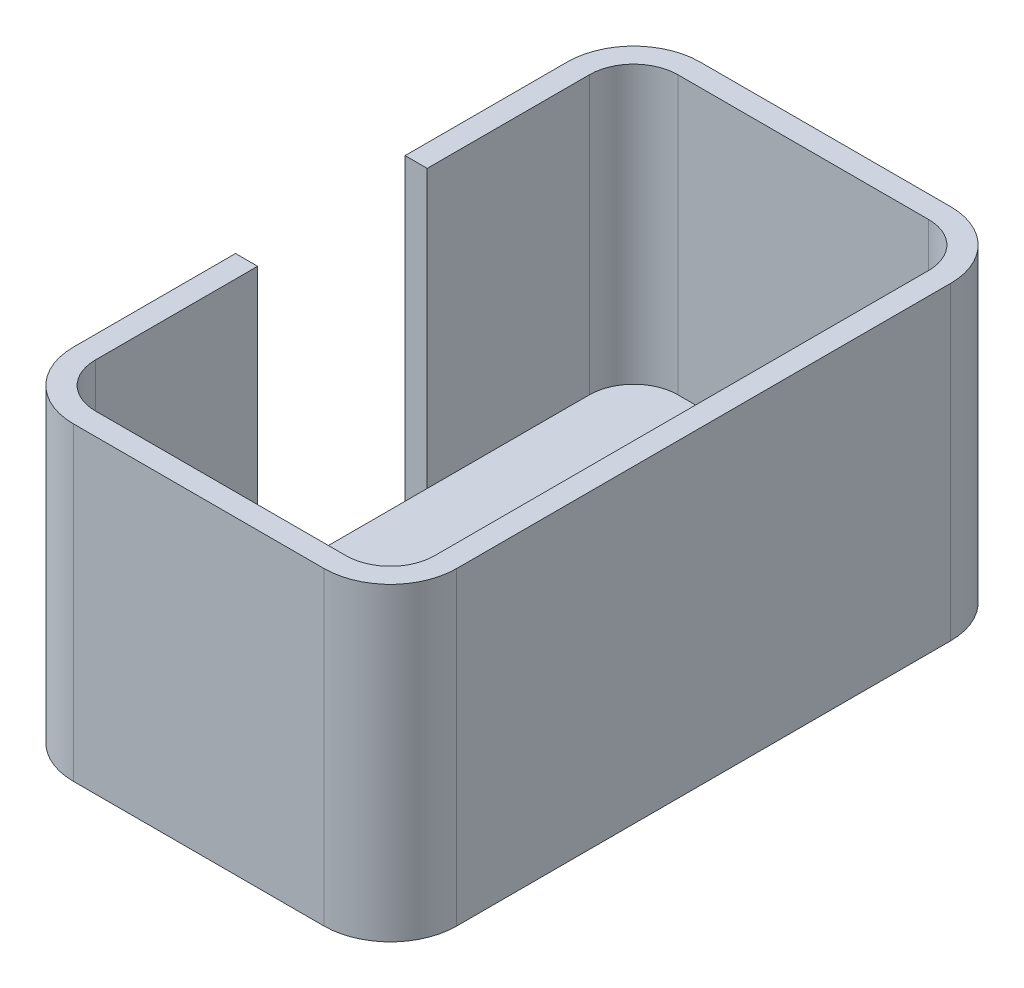
from build123d import *

# Parameters (mm, degrees)
EXTRUDE_1_DEPTH   = 21
EXTRUDE_1_2_DEPTH = 2.2


with BuildPart() as part:
    # 草图2 → Extrude 1 (new body)
    with BuildSketch(Plane(origin=(0, 0, 0), x_dir=(1, 0, 0), z_dir=(0, 1, 0))):
        with BuildLine():
            Line((-11.5, -5.75), (-11.5, -16.75))
            ThreePointArc((-11.5, -16.75), (-10.621320344, -18.871320344), (-8.5, -19.75))
            Line((-8.5, -19.75), (8.5, -19.75))
            ThreePointArc((8.5, -19.75), (10.621320344, -18.871320344), (11.5, -16.75))
            Line((11.5, -16.75), (11.5, 16.75))
            ThreePointArc((11.5, 16.75), (10.621320344, 18.871320344), (8.5, 19.75))
            Line((8.5, 19.75), (-8.5, 19.75))
            ThreePointArc((-8.5, 19.75), (-10.621320344, 18.871320344), (-11.5, 16.75))
            Line((-11.5, 16.75), (-11.5, 5.75))
            Line((-11.5, 5.75), (-13, 5.75))
            Line((-13, 5.75), (-13, 16.75))
            ThreePointArc((-13, 16.75), (-11.681980515, 19.931980515), (-8.5, 21.25))
            Line((-8.5, 21.25), (8.5, 21.25))
            ThreePointArc((8.5, 21.25), (11.681980515, 19.931980515), (13, 16.75))
            Line((13, 16.75), (13, -16.75))
            ThreePointArc((13, -16.75), (11.681980515, -19.931980515), (8.5, -21.25))
            Line((8.5, -21.25), (-8.5, -21.25))
            ThreePointArc((-8.5, -21.25), (-11.681980515, -19.931980515), (-13, -16.75))
            Line((-13, -16.75), (-13, -5.75))
            Line((-13, -5.75), (-11.5, -5.75))
        make_face()
    extrude(amount=EXTRUDE_1_DEPTH)

    # 草图3 → Extrude 1 2 (add)
    with BuildSketch(Plane(origin=(0, 0, 0), x_dir=(1, 0, 0), z_dir=(0, 1, 0))):
        with BuildLine():
            Line((-8.5, -19.75), (8.5, -19.75))
            ThreePointArc((8.5, -19.75), (10.621320344, -18.871320344), (11.5, -16.75))
            Line((11.5, -16.75), (11.5, 16.75))
            ThreePointArc((11.5, 16.75), (10.621320344, 18.871320344), (8.5, 19.75))
            Line((8.5, 19.75), (-8.5, 19.75))
            ThreePointArc((-8.5, 19.75), (-10.621320344, 18.871320344), (-11.5, 16.75))
            Line((-11.5, 16.75), (-11.5, 5.75))
            Line((-11.5, 5.75), (-11.5, 0))
            Line((-11.5, 0), (-11.5, -5.75))
            Line((-11.5, -5.75), (-11.5, -16.75))
            ThreePointArc((-11.5, -16.75), (-10.621320344, -18.871320344), (-8.5, -19.75))
        make_face()
    extrude(amount=EXTRUDE_1_2_DEPTH)


solid = part.part
